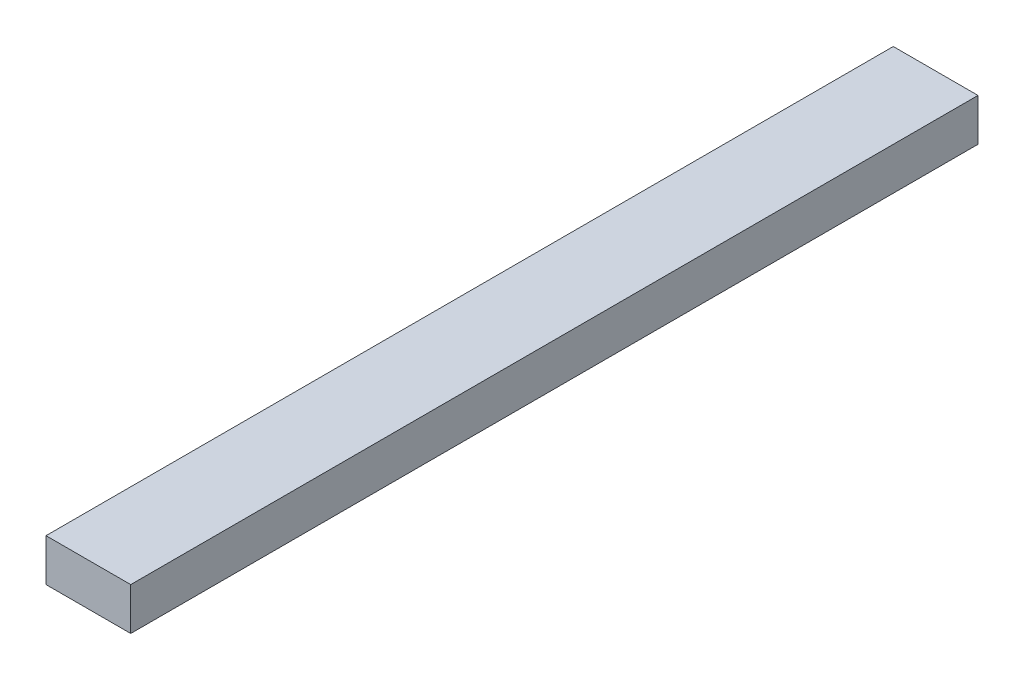
from build123d import *

# Parameters (mm, degrees)
SKETCH1_W           = 2.54
SKETCH1_H           = 1.27
BOSS_EXTRUDE1_DEPTH = 25.4


with BuildPart() as part:
    # Sketch1 → Boss-Extrude1 (new body)
    with BuildSketch(Plane.XY):
        with Locations((-1.27, 0.635)):
            Rectangle(SKETCH1_W, SKETCH1_H)
    extrude(amount=BOSS_EXTRUDE1_DEPTH)


solid = part.part
